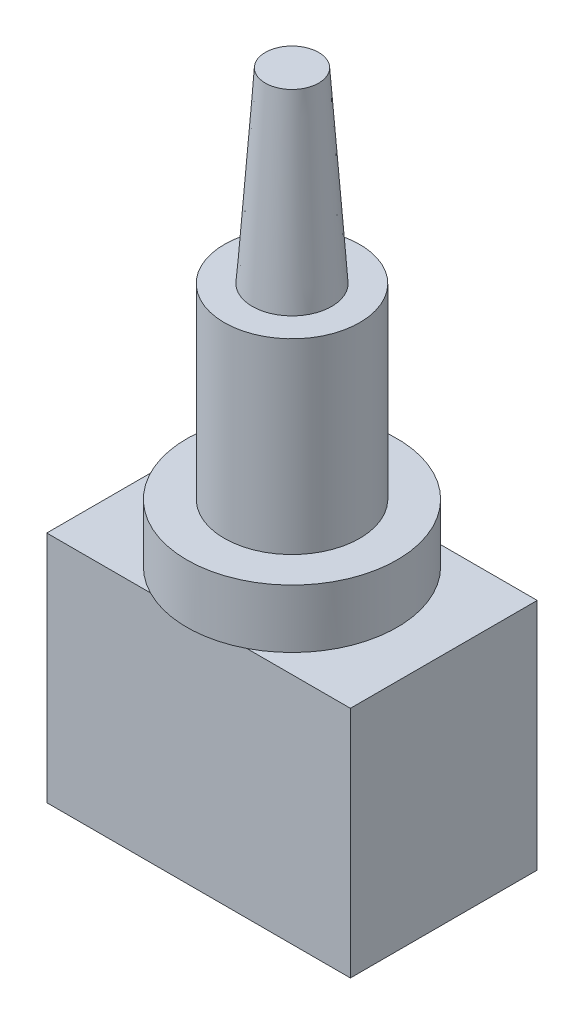
from build123d import *

# Parameters (mm, degrees)
ESQUISSE1_W        = 13
ESQUISSE1_H        = 8
BOSS_EXTRU_1_DEPTH = 10
ESQUISSE2_R        = 4.5
BOSS_EXTRU_2_DEPTH = 2.5
ESQUISSE3_R        = 2.9
BOSS_EXTRU_3_DEPTH = 8
ESQUISSE4_R        = 1.7
BOSS_EXTRU_4_DEPTH = 8
BOSS_EXTRU_4_TAPER = 4


with BuildPart() as part:
    # Esquisse1 → Boss.-Extru.1 (new body)
    with BuildSketch(Plane(origin=(0, 0, 0), x_dir=(1, 0, 0), z_dir=(0, 1, 0))):
        Rectangle(ESQUISSE1_W, ESQUISSE1_H)
    extrude(amount=BOSS_EXTRU_1_DEPTH)

    # Esquisse2 → Boss.-Extru.2 (add)
    with BuildSketch(Plane(origin=(0, 10, 0), x_dir=(1, 0, 0), z_dir=(0, 1, 0))):
        with Locations(Location((0, 0, 0), (0, 0, 62.733955549))):
            Circle(ESQUISSE2_R)
    extrude(amount=BOSS_EXTRU_2_DEPTH)

    # Esquisse3 → Boss.-Extru.3 (add)
    with BuildSketch(Plane(origin=(0, 12.5, 0), x_dir=(1, 0, 0), z_dir=(0, 1, 0))):
        with Locations(Location((0, 0, 0), (0, 0, 270))):
            Circle(ESQUISSE3_R)
    extrude(amount=BOSS_EXTRU_3_DEPTH)

    # Esquisse4 → Boss.-Extru.4 (add)
    with BuildSketch(Plane(origin=(0, 20.5, 0), x_dir=(1, 0, 0), z_dir=(0, 1, 0))):
        Circle(ESQUISSE4_R)
    extrude(amount=BOSS_EXTRU_4_DEPTH, taper=BOSS_EXTRU_4_TAPER)


solid = part.part
